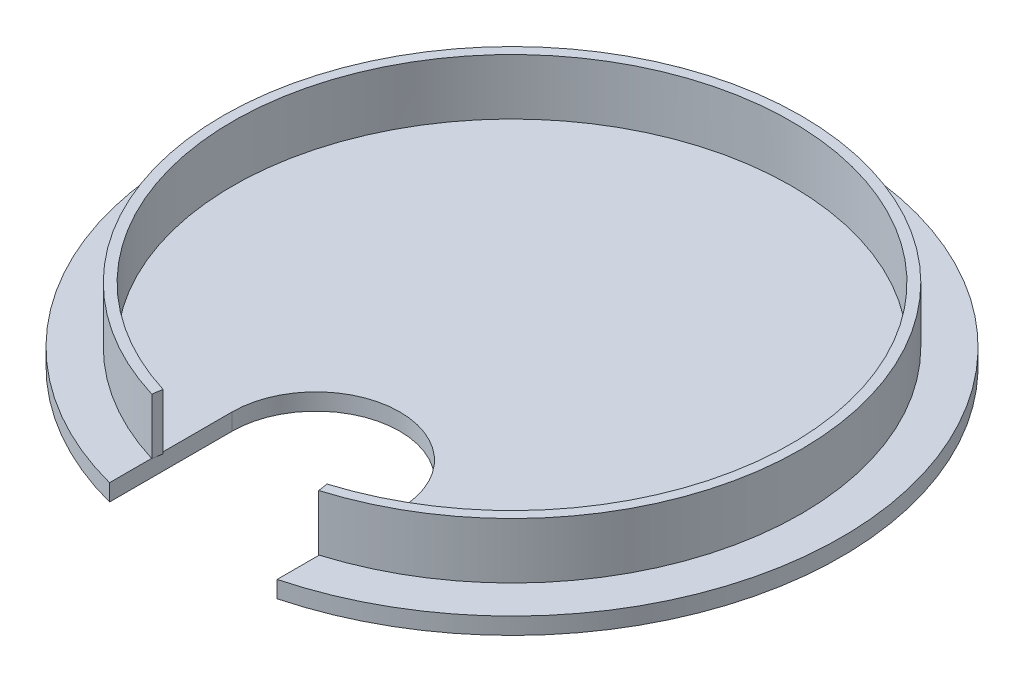
from build123d import *

# Parameters (mm, degrees)
SKETCH1_R           = 59
BOSS_EXTRUDE1_DEPTH = 3
SKETCH3_R           = 51.75
BOSS_EXTRUDE2_DEPTH = 10
SKETCH4_R           = 50
CUT_EXTRUDE2_DEPTH  = 10
SCALE1_SCALE        = 0.5
SKETCH5_R           = 7.5
CUT_EXTRUDE3_DEPTH  = 15
SKETCH6_R           = 7.5
CUT_EXTRUDE4_DEPTH  = 15
SKETCH7_R           = 7.5
CUT_EXTRUDE5_DEPTH  = 15
SKETCH8_W           = 15
SKETCH8_H           = 16.086629849
CUT_EXTRUDE6_DEPTH  = 15


with BuildPart() as part:
    # Sketch1 → Boss-Extrude1 (new body)
    with BuildSketch(Plane(origin=(0, 0, 0), x_dir=(1, 0, 0), z_dir=(0, 1, 0))):
        with Locations(Location((0, 0, 0), (0, 0, 270))):
            Circle(SKETCH1_R)
    extrude(amount=BOSS_EXTRUDE1_DEPTH)

    # Sketch3 → Boss-Extrude2 (add)
    with BuildSketch(Plane(origin=(0, 3, 0), x_dir=(1, 0, 0), z_dir=(0, 1, 0))):
        with Locations(Location((0, 0, 0), (0, 0, 270))):
            Circle(SKETCH3_R)
    extrude(amount=BOSS_EXTRUDE2_DEPTH)

    # Sketch4 → Cut-Extrude2 (cut)
    with BuildSketch(Plane(origin=(0, 13, 0), x_dir=(1, 0, 0), z_dir=(0, 1, 0))):
        with Locations(Location((0, 0, 0), (0, 0, 270))):
            Circle(SKETCH4_R)
    extrude(amount=-CUT_EXTRUDE2_DEPTH, mode=Mode.SUBTRACT)


with BuildPart() as part_1:
    # Scale1: scaled about (0, 2.446860076, 0)
    add(part.part.scale(SCALE1_SCALE).moved(Location((0, 1.223430038, 0))))

    # Sketch5 → Cut-Extrude3 (cut)
    with BuildSketch(Plane(origin=(0, 2.723430038, 0), x_dir=(1, 0, 0), z_dir=(0, 1, 0))):
        with Locations(Location((0, -17.548132192, 0), (0, 0, 270))):
            Circle(SKETCH5_R)
    extrude(amount=-CUT_EXTRUDE3_DEPTH, mode=Mode.SUBTRACT)

    # Sketch6 → Cut-Extrude4 (cut)
    with BuildSketch(Plane(origin=(0, 7.723430038, 0), x_dir=(1, 0, 0), z_dir=(0, 1, 0))):
        with Locations((0, -25.513831206)):
            Circle(SKETCH6_R)
    extrude(amount=-CUT_EXTRUDE4_DEPTH, mode=Mode.SUBTRACT)

    # Sketch7 → Cut-Extrude5 (cut)
    with BuildSketch(Plane(origin=(0, 7.723430038, 0), x_dir=(1, 0, 0), z_dir=(0, 1, 0))):
        with Locations((0, -20.692487066)):
            Circle(SKETCH7_R)
    extrude(amount=-CUT_EXTRUDE5_DEPTH, mode=Mode.SUBTRACT)

    # Sketch8 → Cut-Extrude6 (cut)
    with BuildSketch(Plane(origin=(0, 2.723430038, 0), x_dir=(1, 0, 0), z_dir=(0, 1, 0))):
        with Locations((0, -25.591447116)):
            Rectangle(SKETCH8_W, SKETCH8_H)
    extrude(amount=-CUT_EXTRUDE6_DEPTH, mode=Mode.SUBTRACT)


solid = part_1.part
